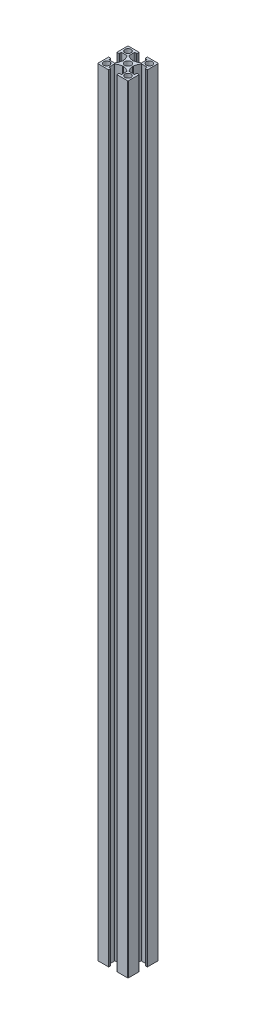
from build123d import *

# Parameters (mm, degrees)
SKETCH_1_R      = 2.15
SKETCH_1_R_2    = 2
EXTRUDE_1_DEPTH = 510


with BuildPart() as part:
    # 스케치1 → 보스-돌출1 (new body)
    with BuildSketch(Plane(origin=(0, 0, 0), x_dir=(1, 0, 0), z_dir=(0, 1, 0))):
        with BuildLine():
            Line((4.15, 4.942749448), (4.15, 8.2))
            ThreePointArc((4.15, 8.2), (4.062132034, 8.412132034), (3.85, 8.5))
            Line((3.85, 8.5), (2.95, 8.5))
            ThreePointArc((2.95, 8.5), (2.737867966, 8.587867966), (2.65, 8.8))
            Line((2.65, 8.8), (2.65, 9.7))
            ThreePointArc((2.65, 9.7), (2.737867966, 9.912132034), (2.95, 10))
            Line((2.95, 10), (9.7, 10))
            ThreePointArc((9.7, 10), (9.912132034, 9.912132034), (10, 9.7))
            Line((10, 9.7), (10, 2.95))
            ThreePointArc((10, 2.95), (9.912132034, 2.737867966), (9.7, 2.65))
            Line((9.7, 2.65), (8.8, 2.65))
            ThreePointArc((8.8, 2.65), (8.587867966, 2.737867966), (8.5, 2.95))
            Line((8.5, 2.95), (8.5, 3.85))
            ThreePointArc((8.5, 3.85), (8.412132034, 4.062132034), (8.2, 4.15))
            Line((8.2, 4.15), (4.942749448, 4.15))
            ThreePointArc((4.942749448, 4.15), (4.812307598, 4.120157221), (4.707817398, 4.03656616))
            ThreePointArc((4.707817398, 4.03656616), (3.714379176, 2.282021525), (3.307277366, 0.307277366))
            Line((3.307277366, 0.307277366), (3, 0))
            Line((3, 0), (3.307277366, -0.307277366))
            ThreePointArc((3.307277366, -0.307277366), (3.714379176, -2.282021525), (4.707817398, -4.03656616))
            ThreePointArc((4.707817398, -4.03656616), (4.812307598, -4.120157221), (4.942749448, -4.15))
            Line((4.942749448, -4.15), (8.2, -4.15))
            ThreePointArc((8.2, -4.15), (8.412132034, -4.062132034), (8.5, -3.85))
            Line((8.5, -3.85), (8.5, -2.95))
            ThreePointArc((8.5, -2.95), (8.587867966, -2.737867966), (8.8, -2.65))
            Line((8.8, -2.65), (9.7, -2.65))
            ThreePointArc((9.7, -2.65), (9.912132034, -2.737867966), (10, -2.95))
            Line((10, -2.95), (10, -9.7))
            ThreePointArc((10, -9.7), (9.912132034, -9.912132034), (9.7, -10))
            Line((9.7, -10), (2.95, -10))
            ThreePointArc((2.95, -10), (2.737867966, -9.912132034), (2.65, -9.7))
            Line((2.65, -9.7), (2.65, -8.8))
            ThreePointArc((2.65, -8.8), (2.737867966, -8.587867966), (2.95, -8.5))
            Line((2.95, -8.5), (3.85, -8.5))
            ThreePointArc((3.85, -8.5), (4.062132034, -8.412132034), (4.15, -8.2))
            Line((4.15, -8.2), (4.15, -4.942749448))
            ThreePointArc((4.15, -4.942749448), (4.120157221, -4.812307598), (4.03656616, -4.707817398))
            ThreePointArc((4.03656616, -4.707817398), (2.282021525, -3.714379176), (0.307277366, -3.307277366))
            Line((0.307277366, -3.307277366), (0, -3))
            Line((0, -3), (-0.307277366, -3.307277366))
            ThreePointArc((-0.307277366, -3.307277366), (-2.282021525, -3.714379176), (-4.03656616, -4.707817398))
            ThreePointArc((-4.03656616, -4.707817398), (-4.120157221, -4.812307598), (-4.15, -4.942749448))
            Line((-4.15, -4.942749448), (-4.15, -8.2))
            ThreePointArc((-4.15, -8.2), (-4.062132034, -8.412132034), (-3.85, -8.5))
            Line((-3.85, -8.5), (-2.95, -8.5))
            ThreePointArc((-2.95, -8.5), (-2.737867966, -8.587867966), (-2.65, -8.8))
            Line((-2.65, -8.8), (-2.65, -9.7))
            ThreePointArc((-2.65, -9.7), (-2.737867966, -9.912132034), (-2.95, -10))
            Line((-2.95, -10), (-9.7, -10))
            ThreePointArc((-9.7, -10), (-9.912132034, -9.912132034), (-10, -9.7))
            Line((-10, -9.7), (-10, -2.95))
            ThreePointArc((-10, -2.95), (-9.912132034, -2.737867966), (-9.7, -2.65))
            Line((-9.7, -2.65), (-8.8, -2.65))
            ThreePointArc((-8.8, -2.65), (-8.587867966, -2.737867966), (-8.5, -2.95))
            Line((-8.5, -2.95), (-8.5, -3.85))
            ThreePointArc((-8.5, -3.85), (-8.412132034, -4.062132034), (-8.2, -4.15))
            Line((-8.2, -4.15), (-4.942749448, -4.15))
            ThreePointArc((-4.942749448, -4.15), (-4.812307598, -4.120157221), (-4.707817398, -4.03656616))
            ThreePointArc((-4.707817398, -4.03656616), (-3.714379176, -2.282021525), (-3.307277366, -0.307277366))
            Line((-3.307277366, -0.307277366), (-3, 0))
            Line((-3, 0), (-3.307277366, 0.307277366))
            ThreePointArc((-3.307277366, 0.307277366), (-3.714379176, 2.282021525), (-4.707817398, 4.03656616))
            ThreePointArc((-4.707817398, 4.03656616), (-4.812307598, 4.120157221), (-4.942749448, 4.15))
            Line((-4.942749448, 4.15), (-8.2, 4.15))
            ThreePointArc((-8.2, 4.15), (-8.412132034, 4.062132034), (-8.5, 3.85))
            Line((-8.5, 3.85), (-8.5, 2.95))
            ThreePointArc((-8.5, 2.95), (-8.587867966, 2.737867966), (-8.8, 2.65))
            Line((-8.8, 2.65), (-9.7, 2.65))
            ThreePointArc((-9.7, 2.65), (-9.912132034, 2.737867966), (-10, 2.95))
            Line((-10, 2.95), (-10, 9.7))
            ThreePointArc((-10, 9.7), (-9.912132034, 9.912132034), (-9.7, 10))
            Line((-9.7, 10), (-2.95, 10))
            ThreePointArc((-2.95, 10), (-2.737867966, 9.912132034), (-2.65, 9.7))
            Line((-2.65, 9.7), (-2.65, 8.8))
            ThreePointArc((-2.65, 8.8), (-2.737867966, 8.587867966), (-2.95, 8.5))
            Line((-2.95, 8.5), (-3.85, 8.5))
            ThreePointArc((-3.85, 8.5), (-4.062132034, 8.412132034), (-4.15, 8.2))
            Line((-4.15, 8.2), (-4.15, 4.942749448))
            ThreePointArc((-4.15, 4.942749448), (-4.120157221, 4.812307598), (-4.03656616, 4.707817398))
            ThreePointArc((-4.03656616, 4.707817398), (-2.282021525, 3.714379176), (-0.307277366, 3.307277366))
            Line((-0.307277366, 3.307277366), (0, 3))
            Line((0, 3), (0.307277366, 3.307277366))
            ThreePointArc((0.307277366, 3.307277366), (2.282021525, 3.714379176), (4.03656616, 4.707817398))
            ThreePointArc((4.03656616, 4.707817398), (4.120157221, 4.812307598), (4.15, 4.942749448))
        make_face()
        with Locations(Location((0, 0, 0), (0, 0, 270))):
            Circle(SKETCH_1_R, mode=Mode.SUBTRACT)
        with Locations(Location((-7, 7, 0), (0, 0, 270))):
            Circle(SKETCH_1_R_2, mode=Mode.SUBTRACT)
        with Locations(Location((-7, -7, 0), (0, 0, 270))):
            Circle(SKETCH_1_R_2, mode=Mode.SUBTRACT)
        with Locations(Location((7, 7, 0), (0, 0, 270))):
            Circle(SKETCH_1_R_2, mode=Mode.SUBTRACT)
        with Locations(Location((7, -7, 0), (0, 0, 270))):
            Circle(SKETCH_1_R_2, mode=Mode.SUBTRACT)
    extrude(amount=EXTRUDE_1_DEPTH)


solid = part.part
